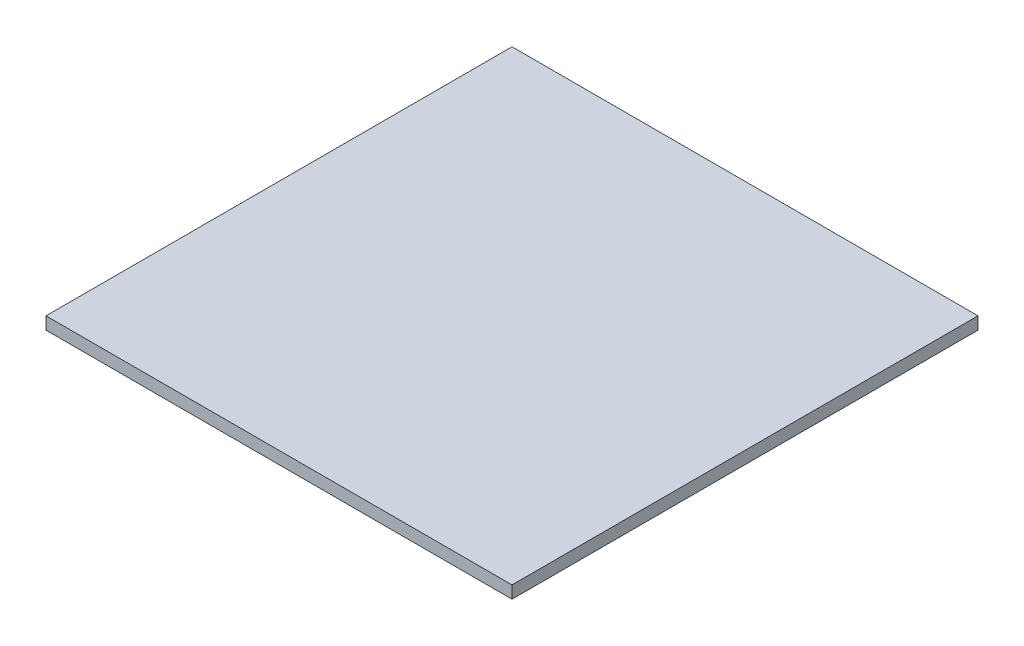
from build123d import *

# Parameters (mm, degrees)
SKETCH1_W           = 300
SKETCH1_H           = 300
BOSS_EXTRUDE1_DEPTH = 8


with BuildPart() as part:
    # Sketch1 → Boss-Extrude1 (new body)
    with BuildSketch(Plane(origin=(0, 0, 0), x_dir=(1, 0, 0), z_dir=(0, 1, 0))):
        Rectangle(SKETCH1_W, SKETCH1_H)
    extrude(amount=BOSS_EXTRUDE1_DEPTH)


solid = part.part
